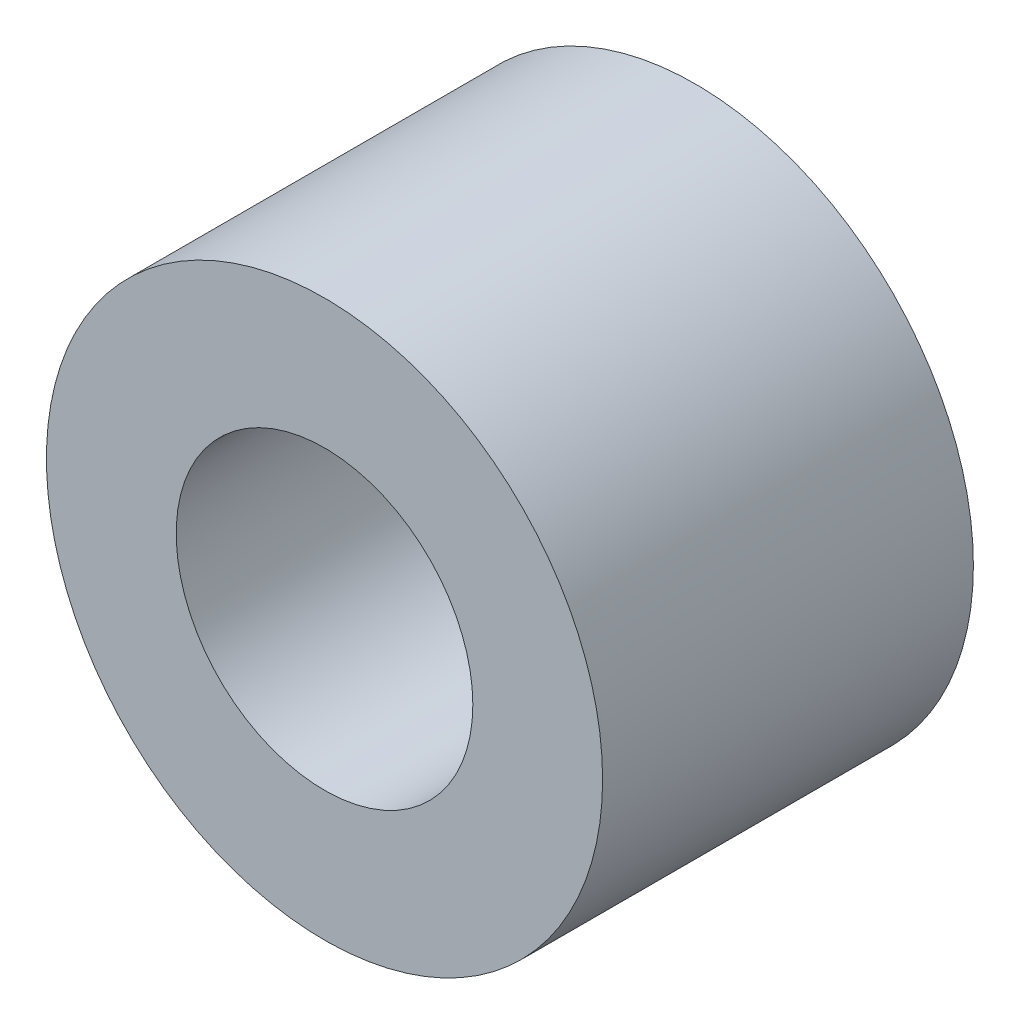
from build123d import *

# Parameters (mm, degrees)
SKETCH_1_R      = 3
SKETCH_1_R_2    = 1.6
EXTRUDE_1_DEPTH = 2


with BuildPart() as part:
    # 草图1 → 凸台-拉伸1 (new, symmetric)
    with BuildSketch(Plane.XY):
        Circle(SKETCH_1_R)
        Circle(SKETCH_1_R_2, mode=Mode.SUBTRACT)
    extrude(amount=EXTRUDE_1_DEPTH, both=True)


solid = part.part
